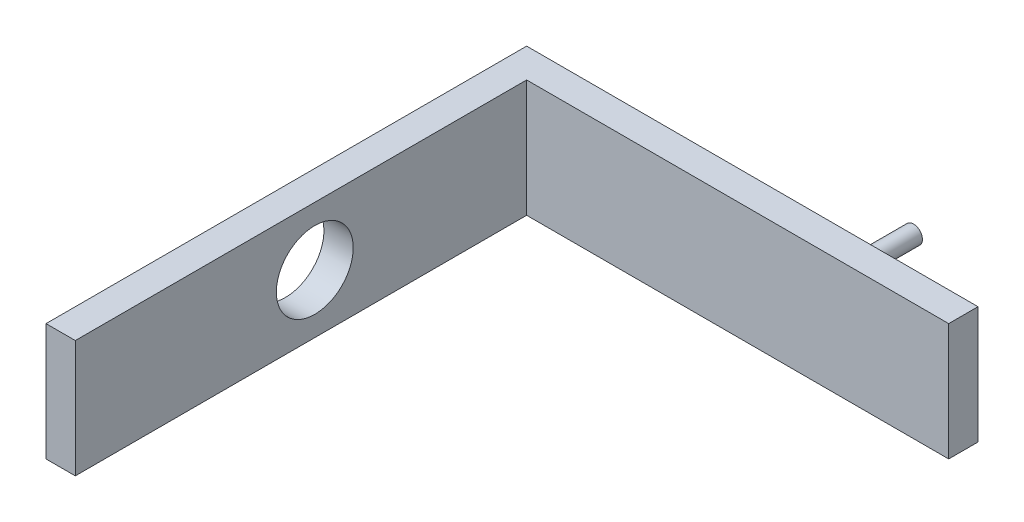
from build123d import *

# Parameters (mm, degrees)
BOSS_EXTRUDE1_DEPTH = 7.9375
SKETCH3_R           = 5.207
CUT_EXTRUDE1_DEPTH  = 3.96875
SKETCH4_R           = 1.2065
BOSS_EXTRUDE2_DEPTH = 12.065


with BuildPart() as part:
    # Sketch1 → Boss-Extrude1 (new, symmetric)
    with BuildSketch(Plane(origin=(0, 0, 0), x_dir=(1, 0, 0), z_dir=(0, 1, 0))):
        Polygon((-2.757708096, -19.86108723), (1.211041904, -19.86108723), (1.211041904, 41.25766277), (58.361041904, 41.25766277), (58.361041904, 45.22641277), (6.27967861, 45.22641277), (-2.757708096, 45.22641277), align=None)
    extrude(amount=BOSS_EXTRUDE1_DEPTH, both=True)

    # Sketch3 → Cut-Extrude1 (cut)
    with BuildSketch(Plane.ZY.offset(2.757708096)):
        with Locations((-12.566559842, 0)):
            Circle(SKETCH3_R)
    extrude(amount=-CUT_EXTRUDE1_DEPTH, mode=Mode.SUBTRACT)

    # Sketch4 → Boss-Extrude2 (add)
    with BuildSketch(Plane(origin=(0, 0, -45.22641277), x_dir=(-1, 0, 0), z_dir=(0, 0, -1))):
        with Locations(Location((-37.564791904, 0, 0), (0, 0, 180))):
            Circle(SKETCH4_R)
    extrude(amount=BOSS_EXTRUDE2_DEPTH)


solid = part.part
